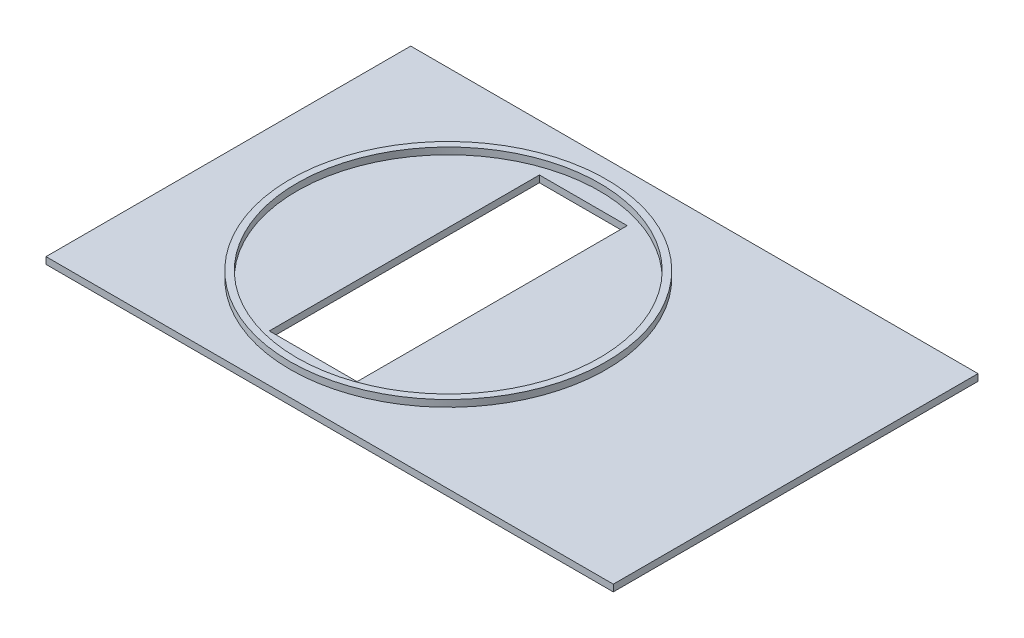
from build123d import *

# Parameters (mm, degrees)
BOSS_EXTRUDE1_DEPTH = 10
BOSS_EXTRUDE2_DEPTH = 10


with BuildPart() as part:
    # Sketch1 → Boss-Extrude1 (new body)
    with BuildSketch(Plane(origin=(0, 0, 0), x_dir=(1, 0, 0), z_dir=(0, 1, 0))):
        Polygon((514.396103797, 270), (0, 270), (-325.603896203, 270), (-325.603896203, -270), (514.396103797, -270), align=None)
        Polygon((-65, 200), (0, 200), (65, 200), (65, -200), (-65, -200), align=None, mode=Mode.SUBTRACT)
    extrude(amount=-BOSS_EXTRUDE1_DEPTH)

    # Sketch1<3> → Boss-Extrude2 (add)
    with BuildSketch(Plane(origin=(0, 0, 0), x_dir=(1, 0, 0), z_dir=(0, 1, 0))):
        with BuildLine():
            ThreePointArc((234, 0), (165.462986798, 165.462986798), (0, 234))
            ThreePointArc((0, 234), (-165.462986798, -165.462986798), (234, 0))
        make_face()
        with BuildLine():
            ThreePointArc((224, 0), (-158.391918986, -158.391918986), (0, 224))
            ThreePointArc((0, 224), (158.391918986, 158.391918986), (224, 0))
        make_face(mode=Mode.SUBTRACT)
    extrude(amount=BOSS_EXTRUDE2_DEPTH)


solid = part.part
